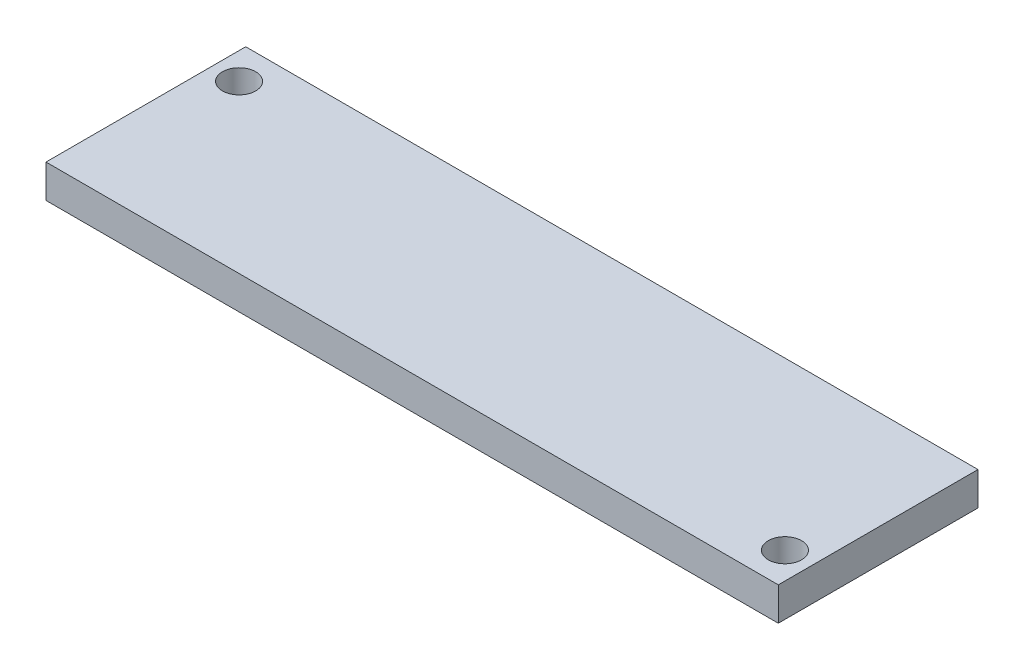
from build123d import *

# Parameters (mm, degrees)
SKIZZE1_W                       = 110
SKIZZE1_H                       = 30
SKIZZE1_R                       = 2.5
AUFSATZ_LINEAR_AUSTRAGEN1_DEPTH = 5


with BuildPart() as part:
    # Skizze1 → Aufsatz-Linear austragen1 (new body)
    with BuildSketch(Plane(origin=(0, 0, 0), x_dir=(1, 0, 0), z_dir=(0, 1, 0))):
        Rectangle(SKIZZE1_W, SKIZZE1_H)
        with Locations(Location((-51, 10, 0), (0, 0, 270))):
            Circle(SKIZZE1_R, mode=Mode.SUBTRACT)
        with Locations(Location((51, -10, 0), (0, 0, 270))):
            Circle(SKIZZE1_R, mode=Mode.SUBTRACT)
    extrude(amount=AUFSATZ_LINEAR_AUSTRAGEN1_DEPTH)


solid = part.part
